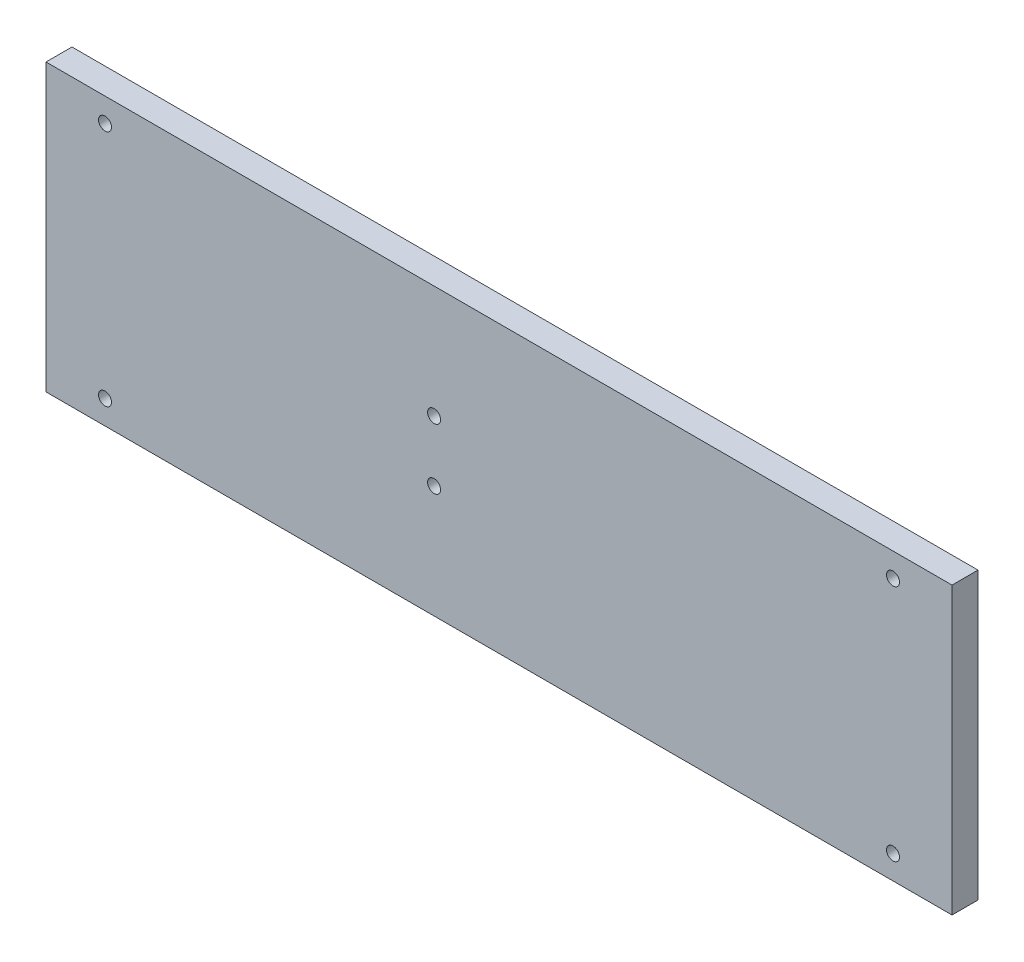
from build123d import *

# Parameters (mm, degrees)
ESQUISSE1_W             = 209.26
ESQUISSE1_H             = 66
BOSS_EXTRU_1_DEPTH      = 6
ESQUISSE2_R             = 1.5
ENL_V_MAT_EXTRU_1_DEPTH = 6


with BuildPart() as part:
    # Esquisse1 → Boss.-Extru.1 (new body)
    with BuildSketch(Plane.XY):
        Rectangle(ESQUISSE1_W, ESQUISSE1_H)
    extrude(amount=BOSS_EXTRU_1_DEPTH)

    # Esquisse2 → Enlèv. mat.-Extru.1 (cut)
    with BuildSketch(Plane.XY.offset(6)):
        with Locations((-15, 7)):
            Circle(ESQUISSE2_R)
        with Locations((-15, -7)):
            Circle(ESQUISSE2_R)
        with Locations((91, 27.5)):
            Circle(ESQUISSE2_R)
        with Locations((91, -27.5)):
            Circle(ESQUISSE2_R)
        with Locations(Location((-91, -27.5, 0), (0, 0, 180))):
            Circle(ESQUISSE2_R)
        with Locations(Location((-91, 27.5, 0), (0, 0, 180))):
            Circle(ESQUISSE2_R)
    extrude(amount=-ENL_V_MAT_EXTRU_1_DEPTH, mode=Mode.SUBTRACT)


solid = part.part
